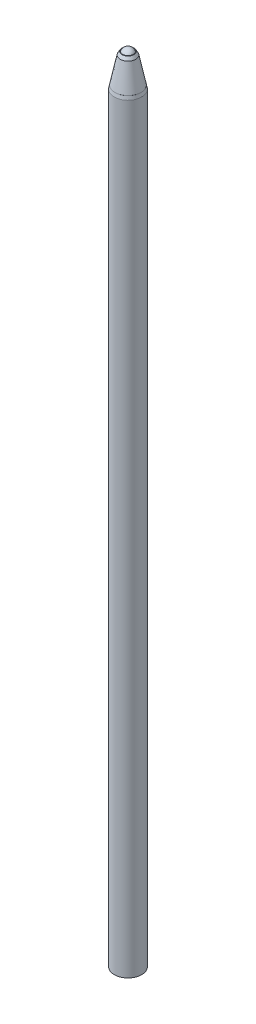
from build123d import *


with BuildPart() as part:
    # Sketch1 → Revolve2 (revolve)
    with BuildSketch(Plane(origin=(0, 0, 0), x_dir=(0, 0, -1), z_dir=(1, 0, 0)), mode=Mode.PRIVATE) as revolve2_sk:
        Polygon((0.4, 12.66900418), (0.25, 12.75560672), (0.25, 13.06664991), (0.499999999, 13.210987477), (0.499999999, 13.65), (0.45958548, 13.72), (0.505, 13.72), (0.66, 13.451532125), (1.113571716, 11.22195665), (1.111006501, 11.22), (1.113969765, 11.22), (1.175, 10.92), (1.175, -2.03), (1.175, -54.11), (0, -54.11), (0, 0), (0.45, 0), (0.45, 8.84), (0.4, 8.89), align=None)
    revolve(revolve2_sk.sketch.rotate(Axis((0, 13.79485497, 0), (0, -1, 0)), 180), axis=Axis((0, 13.79485497, 0), (0, -1, 0)))


with BuildPart() as body_2:
    # Esboço1 → Revolução1 (revolve)
    with BuildSketch(Plane.XY):
        with BuildLine():
            Line((0, 13), (0, 14))
            ThreePointArc((0, 14), (-0.5, 13.5), (0, 13))
        make_face()
    revolve(axis=Axis((0, 13, 0), (0, 1, 0)))


solid = Compound([part.part, body_2.part])
